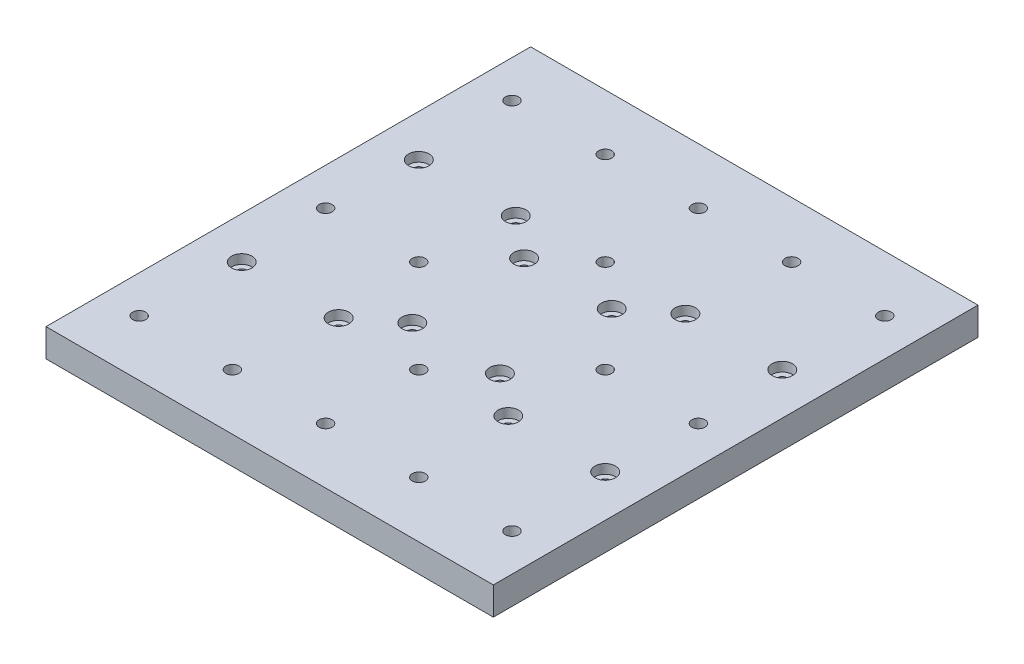
from build123d import *

# Parameters (mm, degrees)
CROQUIS1_W              = 240
CROQUIS1_H              = 260
SALIENTE_EXTRUIR1_DEPTH = 15
CROQUIS6_R              = 2.55
CORTAR_EXTRUIR3_DEPTH   = 178.552809046
CROQUIS7_R              = 5.5
CORTAR_EXTRUIR4_DEPTH   = 5
CROQUIS8_R              = 3.5
CORTAR_EXTRUIR5_DEPTH   = 178.552809046
CORTAR_EXTRUIR6_REACH   = 179.553
CROQUIS9_R              = 2.625
CROQUIS10_R             = 5.5
CORTAR_EXTRUIR7_DEPTH   = 5


with BuildPart() as part:
    # Croquis1 → Saliente-Extruir1 (new body)
    with BuildSketch(Plane(origin=(0, 0, 0), x_dir=(1, 0, 0), z_dir=(0, 1, 0))):
        Rectangle(CROQUIS1_W, CROQUIS1_H)
    extrude(amount=SALIENTE_EXTRUIR1_DEPTH)

    # Croquis6 → Cortar-Extruir3 (cut, through all)
    with BuildSketch(Plane.XZ):
        with Locations(Location((-45.5, -47.5, 0), (0, 0, 270))):
            Circle(CROQUIS6_R)
        with Locations(Location((-97.5, -47.5, 0), (0, 0, 270))):
            Circle(CROQUIS6_R)
        with Locations(Location((-97.5, 47.5, 0), (0, 0, 270))):
            Circle(CROQUIS6_R)
        with Locations(Location((-45.5, 47.5, 0), (0, 0, 270))):
            Circle(CROQUIS6_R)
        with Locations(Location((45.5, 47.5, 0), (0, 0, 270))):
            Circle(CROQUIS6_R)
        with Locations(Location((97.5, 47.5, 0), (0, 0, 270))):
            Circle(CROQUIS6_R)
        with Locations(Location((45.5, -47.5, 0), (0, 0, 270))):
            Circle(CROQUIS6_R)
        with Locations(Location((97.5, -47.5, 0), (0, 0, 270))):
            Circle(CROQUIS6_R)
    extrude(amount=-CORTAR_EXTRUIR3_DEPTH, mode=Mode.SUBTRACT)

    # Croquis7 → Cortar-Extruir4 (cut)
    with BuildSketch(Plane(origin=(0, 15, 0), x_dir=(1, 0, 0), z_dir=(0, 1, 0))):
        with Locations(Location((-97.5, 47.5, 0), (0, 0, 270))):
            Circle(CROQUIS7_R)
        with Locations(Location((-45.5, 47.5, 0), (0, 0, 270))):
            Circle(CROQUIS7_R)
        with Locations(Location((-97.5, -47.5, 0), (0, 0, 270))):
            Circle(CROQUIS7_R)
        with Locations(Location((-45.5, -47.5, 0), (0, 0, 270))):
            Circle(CROQUIS7_R)
        with Locations(Location((45.5, -47.5, 0), (0, 0, 270))):
            Circle(CROQUIS7_R)
        with Locations(Location((97.5, -47.5, 0), (0, 0, 270))):
            Circle(CROQUIS7_R)
        with Locations(Location((97.5, 47.5, 0), (0, 0, 270))):
            Circle(CROQUIS7_R)
        with Locations(Location((45.5, 47.5, 0), (0, 0, 270))):
            Circle(CROQUIS7_R)
    extrude(amount=-CORTAR_EXTRUIR4_DEPTH, mode=Mode.SUBTRACT)

    # Croquis8 → Cortar-Extruir5 (cut, through all)
    with BuildSketch(Plane(origin=(0, 15, 0), x_dir=(1, 0, 0), z_dir=(0, 1, 0))):
        with Locations(Location((-100, 100, 0), (0, 0, 270))):
            Circle(CROQUIS8_R)
        with Locations(Location((-50, 100, 0), (0, 0, 270))):
            Circle(CROQUIS8_R)
        with Locations(Location((0, 100, 0), (0, 0, 270))):
            Circle(CROQUIS8_R)
        with Locations(Location((50, 100, 0), (0, 0, 270))):
            Circle(CROQUIS8_R)
        with Locations(Location((100, 100, 0), (0, 0, 270))):
            Circle(CROQUIS8_R)
        with Locations(Location((0, 50, 0), (0, 0, 270))):
            Circle(CROQUIS8_R)
        with Locations(Location((-50, 0, 0), (0, 0, 270))):
            Circle(CROQUIS8_R)
        with Locations(Location((50, 0, 0), (0, 0, 270))):
            Circle(CROQUIS8_R)
        with Locations(Location((100, 0, 0), (0, 0, 270))):
            Circle(CROQUIS8_R)
        with Locations(Location((0, -50, 0), (0, 0, 270))):
            Circle(CROQUIS8_R)
        with Locations(Location((-50, -100, 0), (0, 0, 270))):
            Circle(CROQUIS8_R)
        with Locations(Location((0, -100, 0), (0, 0, 270))):
            Circle(CROQUIS8_R)
        with Locations(Location((50, -100, 0), (0, 0, 270))):
            Circle(CROQUIS8_R)
        with Locations(Location((100, -100, 0), (0, 0, 270))):
            Circle(CROQUIS8_R)
        with Locations(Location((-100, 0, 0), (0, 0, 270))):
            Circle(CROQUIS8_R)
        with Locations(Location((-100, -100, 0), (0, 0, 270))):
            Circle(CROQUIS8_R)
    extrude(amount=-CORTAR_EXTRUIR5_DEPTH, mode=Mode.SUBTRACT)

    # Croquis9 → Cortar-Extruir6 (cut, up to next)
    with BuildSketch(Plane.XZ, mode=Mode.PRIVATE) as cortar_extruir6_sk1:
        with Locations(Location((23.5, 30, 0), (0, 0, 270))):
            Circle(CROQUIS9_R)
    cortar_extruir6_tool1 = extrude(cortar_extruir6_sk1.sketch, amount=-CORTAR_EXTRUIR6_REACH, mode=Mode.PRIVATE) & part.part
    # Croquis9 → Cortar-Extruir6 (cut, up to next)
    with BuildSketch(Plane.XZ, mode=Mode.PRIVATE) as cortar_extruir6_sk2:
        with Locations(Location((-23.5, 30, 0), (0, 0, 270))):
            Circle(CROQUIS9_R)
    cortar_extruir6_tool2 = extrude(cortar_extruir6_sk2.sketch, amount=-CORTAR_EXTRUIR6_REACH, mode=Mode.PRIVATE) & part.part
    # Croquis9 → Cortar-Extruir6 (cut, up to next)
    with BuildSketch(Plane.XZ, mode=Mode.PRIVATE) as cortar_extruir6_sk3:
        with Locations(Location((-23.5, -30, 0), (0, 0, 270))):
            Circle(CROQUIS9_R)
    cortar_extruir6_tool3 = extrude(cortar_extruir6_sk3.sketch, amount=-CORTAR_EXTRUIR6_REACH, mode=Mode.PRIVATE) & part.part
    # Croquis9 → Cortar-Extruir6 (cut, up to next)
    with BuildSketch(Plane.XZ, mode=Mode.PRIVATE) as cortar_extruir6_sk4:
        with Locations(Location((23.5, -30, 0), (0, 0, 270))):
            Circle(CROQUIS9_R)
    cortar_extruir6_tool4 = extrude(cortar_extruir6_sk4.sketch, amount=-CORTAR_EXTRUIR6_REACH, mode=Mode.PRIVATE) & part.part
    add(cortar_extruir6_tool1.solids().sort_by_distance((23.5, 0, 30))[0], mode=Mode.SUBTRACT)
    add(cortar_extruir6_tool2.solids().sort_by_distance((-23.5, 0, 30))[0], mode=Mode.SUBTRACT)
    add(cortar_extruir6_tool3.solids().sort_by_distance((-23.5, 0, -30))[0], mode=Mode.SUBTRACT)
    add(cortar_extruir6_tool4.solids().sort_by_distance((23.5, 0, -30))[0], mode=Mode.SUBTRACT)

    # Croquis10 → Cortar-Extruir7 (cut)
    with BuildSketch(Plane(origin=(0, 15, 0), x_dir=(1, 0, 0), z_dir=(0, 1, 0))):
        with Locations(Location((-23.5, -30, 0), (0, 0, 270))):
            Circle(CROQUIS10_R)
        with Locations(Location((23.5, -30, 0), (0, 0, 270))):
            Circle(CROQUIS10_R)
        with Locations(Location((23.5, 30, 0), (0, 0, 270))):
            Circle(CROQUIS10_R)
        with Locations(Location((-23.5, 30, 0), (0, 0, 270))):
            Circle(CROQUIS10_R)
    extrude(amount=-CORTAR_EXTRUIR7_DEPTH, mode=Mode.SUBTRACT)


solid = part.part
